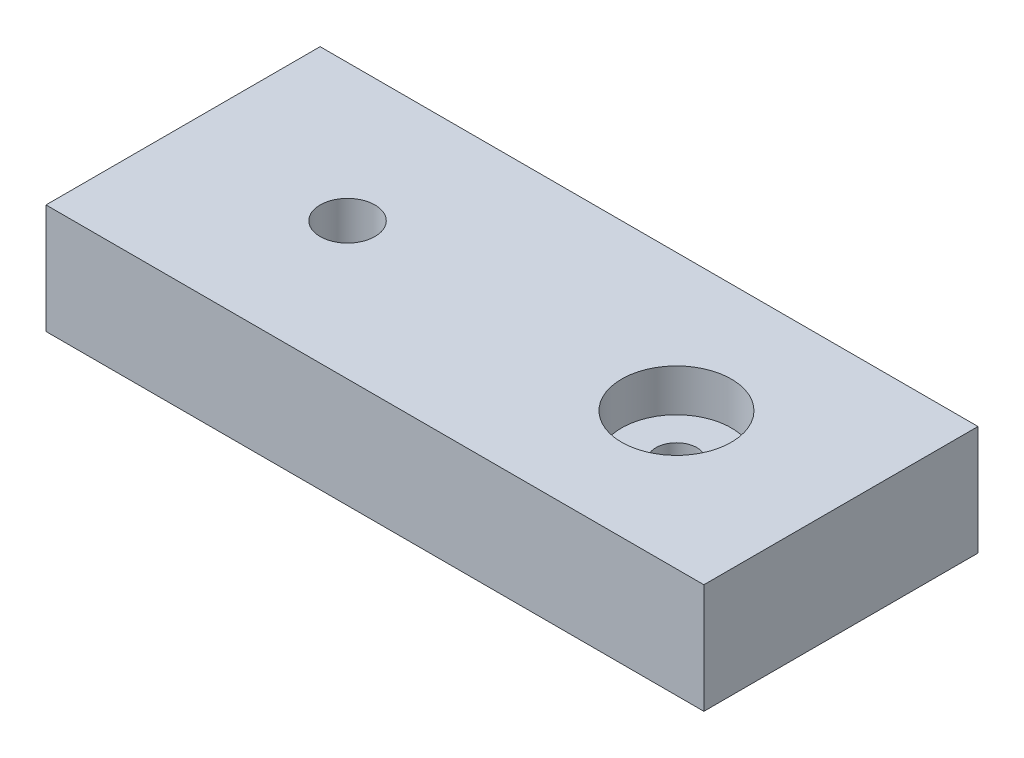
from build123d import *

# Parameters (mm, degrees)
SKETCH1_W           = 76.2
SKETCH1_H           = 31.75
BOSS_EXTRUDE1_DEPTH = 12.7
SKETCH2_R           = 3.175
SKETCH2_R_2         = 2.38125
CUT_EXTRUDE1_DEPTH  = 44.184668865
SKETCH3_R           = 6.35
CUT_EXTRUDE2_DEPTH  = 4.9022


with BuildPart() as part:
    # Sketch1 → Boss-Extrude1 (new body)
    with BuildSketch(Plane(origin=(0, 0, 0), x_dir=(1, 0, 0), z_dir=(0, 1, 0))):
        Rectangle(SKETCH1_W, SKETCH1_H)
    extrude(amount=BOSS_EXTRUDE1_DEPTH)

    # Sketch2 → Cut-Extrude1 (cut, through all)
    with BuildSketch(Plane(origin=(0, 12.7, 0), x_dir=(1, 0, 0), z_dir=(0, 1, 0))):
        with Locations(Location((-19.05, 0, 0), (0, 0, 270))):
            Circle(SKETCH2_R)
        with Locations(Location((19.05, 0, 0), (0, 0, 270))):
            Circle(SKETCH2_R_2)
    extrude(amount=-CUT_EXTRUDE1_DEPTH, mode=Mode.SUBTRACT)

    # Sketch3 → Cut-Extrude2 (cut)
    with BuildSketch(Plane(origin=(0, 12.7, 0), x_dir=(1, 0, 0), z_dir=(0, 1, 0))):
        with Locations(Location((19.05, 0, 0), (0, 0, 270))):
            Circle(SKETCH3_R)
    extrude(amount=-CUT_EXTRUDE2_DEPTH, mode=Mode.SUBTRACT)


solid = part.part
